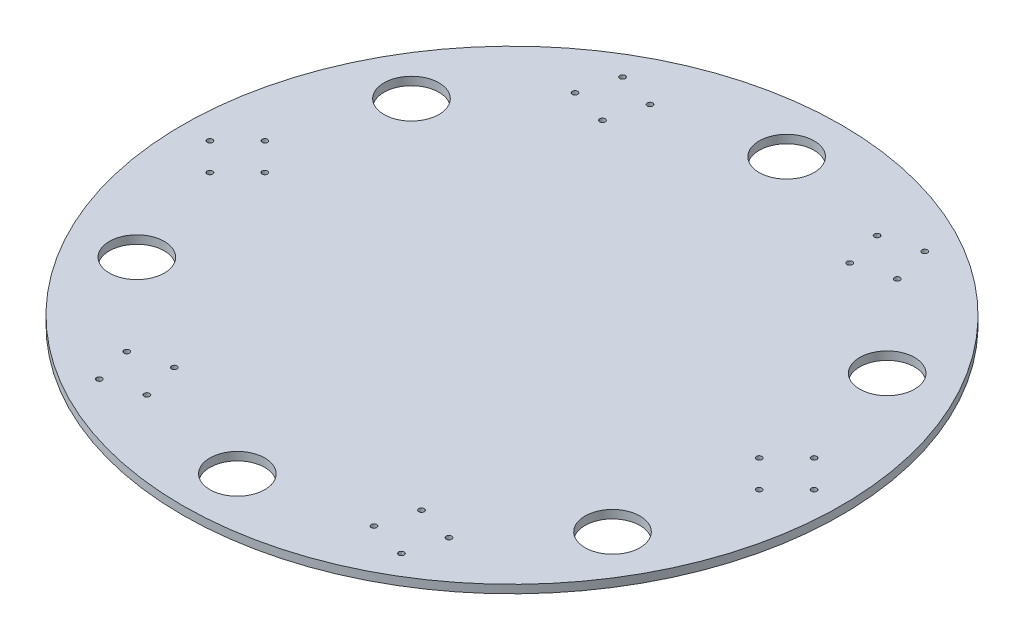
from build123d import *

# Parameters (mm, degrees)
SKETCH1_R           = 120
SKETCH1_R_2         = 1
SKETCH1_R_3         = 10
BOSS_EXTRUDE1_DEPTH = 3


with BuildPart() as part:
    # Sketch1 → Boss-Extrude1 (new body)
    with BuildSketch(Plane(origin=(0, 0, 0), x_dir=(1, 0, 0), z_dir=(0, 1, 0))):
        with Locations(Location((0, 0, 0), (0, 0, 270))):
            Circle(SKETCH1_R)
        with Locations(Location((45, -77.942286341, 0), (0, 0, 270))):
            Circle(SKETCH1_R_2, mode=Mode.SUBTRACT)
        with Locations(Location((58.660254038, -81.602540378, 0), (0, 0, 270))):
            Circle(SKETCH1_R_2, mode=Mode.SUBTRACT)
        with Locations(Location((55, -95.262794416, 0), (0, 0, 270))):
            Circle(SKETCH1_R_2, mode=Mode.SUBTRACT)
        with Locations(Location((41.339745962, -91.602540378, 0), (0, 0, 270))):
            Circle(SKETCH1_R_2, mode=Mode.SUBTRACT)
        with Locations(Location((110, 0, 0), (0, 0, 270))):
            Circle(SKETCH1_R_2, mode=Mode.SUBTRACT)
        with Locations(Location((100, -10, 0), (0, 0, 270))):
            Circle(SKETCH1_R_2, mode=Mode.SUBTRACT)
        with Locations(Location((90, 0, 0), (0, 0, 270))):
            Circle(SKETCH1_R_2, mode=Mode.SUBTRACT)
        with Locations(Location((100, 10, 0), (0, 0, 270))):
            Circle(SKETCH1_R_2, mode=Mode.SUBTRACT)
        with Locations(Location((-45, -77.942286341, 0), (0, 0, 270))):
            Circle(SKETCH1_R_2, mode=Mode.SUBTRACT)
        with Locations(Location((-41.339745962, -91.602540378, 0), (0, 0, 270))):
            Circle(SKETCH1_R_2, mode=Mode.SUBTRACT)
        with Locations(Location((-55, -95.262794416, 0), (0, 0, 270))):
            Circle(SKETCH1_R_2, mode=Mode.SUBTRACT)
        with Locations(Location((-58.660254038, -81.602540378, 0), (0, 0, 270))):
            Circle(SKETCH1_R_2, mode=Mode.SUBTRACT)
        with Locations(Location((-90, 0, 0), (0, 0, 270))):
            Circle(SKETCH1_R_2, mode=Mode.SUBTRACT)
        with Locations(Location((-100, -10, 0), (0, 0, 270))):
            Circle(SKETCH1_R_2, mode=Mode.SUBTRACT)
        with Locations(Location((-110, 0, 0), (0, 0, 270))):
            Circle(SKETCH1_R_2, mode=Mode.SUBTRACT)
        with Locations(Location((-100, 10, 0), (0, 0, 270))):
            Circle(SKETCH1_R_2, mode=Mode.SUBTRACT)
        with Locations(Location((-45, 77.942286341, 0), (0, 0, 270))):
            Circle(SKETCH1_R_2, mode=Mode.SUBTRACT)
        with Locations(Location((-58.660254038, 81.602540378, 0), (0, 0, 270))):
            Circle(SKETCH1_R_2, mode=Mode.SUBTRACT)
        with Locations(Location((-55, 95.262794416, 0), (0, 0, 270))):
            Circle(SKETCH1_R_2, mode=Mode.SUBTRACT)
        with Locations(Location((-41.339745962, 91.602540378, 0), (0, 0, 270))):
            Circle(SKETCH1_R_2, mode=Mode.SUBTRACT)
        with Locations(Location((45, 77.942286341, 0), (0, 0, 270))):
            Circle(SKETCH1_R_2, mode=Mode.SUBTRACT)
        with Locations(Location((41.339745962, 91.602540378, 0), (0, 0, 270))):
            Circle(SKETCH1_R_2, mode=Mode.SUBTRACT)
        with Locations(Location((55, 95.262794416, 0), (0, 0, 270))):
            Circle(SKETCH1_R_2, mode=Mode.SUBTRACT)
        with Locations(Location((58.660254038, 81.602540378, 0), (0, 0, 270))):
            Circle(SKETCH1_R_2, mode=Mode.SUBTRACT)
        with Locations(Location((0, 100, 0), (0, 0, 270))):
            Circle(SKETCH1_R_3, mode=Mode.SUBTRACT)
        with Locations(Location((-86.602540378, 50, 0), (0, 0, 270))):
            Circle(SKETCH1_R_3, mode=Mode.SUBTRACT)
        with Locations(Location((-86.602540378, -50, 0), (0, 0, 270))):
            Circle(SKETCH1_R_3, mode=Mode.SUBTRACT)
        with Locations(Location((0, -100, 0), (0, 0, 270))):
            Circle(SKETCH1_R_3, mode=Mode.SUBTRACT)
        with Locations(Location((86.602540378, -50, 0), (0, 0, 270))):
            Circle(SKETCH1_R_3, mode=Mode.SUBTRACT)
        with Locations(Location((86.602540378, 50, 0), (0, 0, 270))):
            Circle(SKETCH1_R_3, mode=Mode.SUBTRACT)
    extrude(amount=BOSS_EXTRUDE1_DEPTH)


solid = part.part
